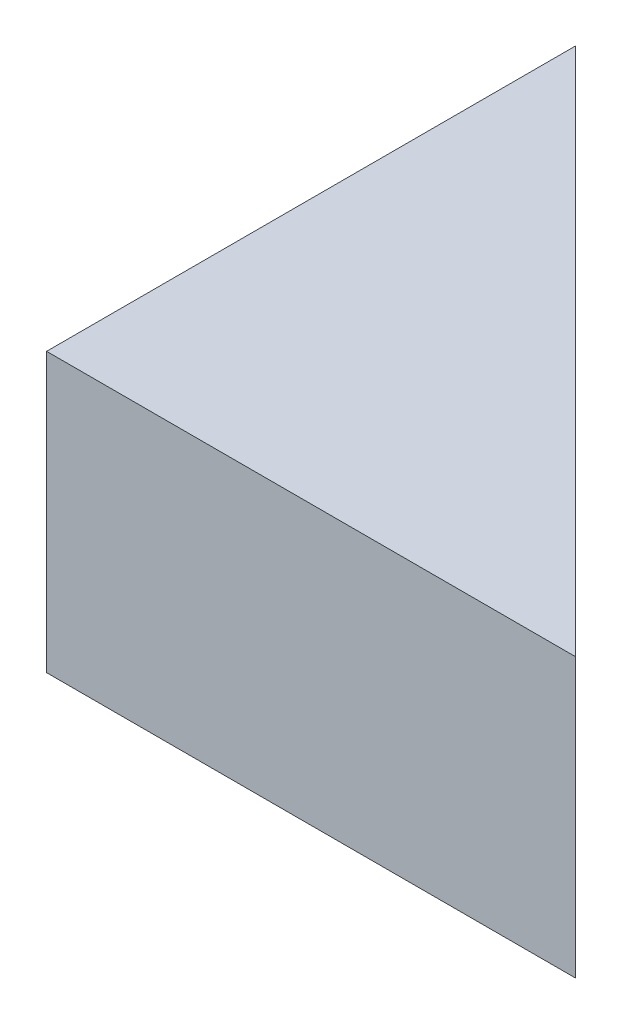
from build123d import *

# Parameters (mm, degrees)
SKETCH2_W           = 38
SKETCH2_H           = 38
BOSS_EXTRUDE1_DEPTH = 20
CUT_EXTRUDE1_DEPTH  = 20
SKETCH7_R           = 2.25
CUT_EXTRUDE2_DEPTH  = 5


with BuildPart() as part:
    # Sketch2 → Boss-Extrude1 (new body)
    with BuildSketch(Plane(origin=(0, 0, 0), x_dir=(1, 0, 0), z_dir=(0, 1, 0))):
        Rectangle(SKETCH2_W, SKETCH2_H)
    extrude(amount=BOSS_EXTRUDE1_DEPTH)

    # Sketch3 → Cut-Extrude1 (cut)
    with BuildSketch(Plane(origin=(0, 20, 0), x_dir=(1, 0, 0), z_dir=(0, 1, 0))):
        Polygon((-19, 19), (19, -19), (19, 19), align=None)
    extrude(amount=-CUT_EXTRUDE1_DEPTH, mode=Mode.SUBTRACT)

    # Sketch7 → Cut-Extrude2 (cut)
    with BuildSketch(Plane(origin=(0, 0, 0), x_dir=(-1, 0, 0), z_dir=(0, -1, 0))):
        with Locations(Location((12.5, 0, 0), (0, 0, 90))):
            Circle(SKETCH7_R)
        with Locations(Location((0, -12.5, 0), (0, 0, 90))):
            Circle(SKETCH7_R)
    extrude(amount=-CUT_EXTRUDE2_DEPTH, mode=Mode.SUBTRACT)


solid = part.part
